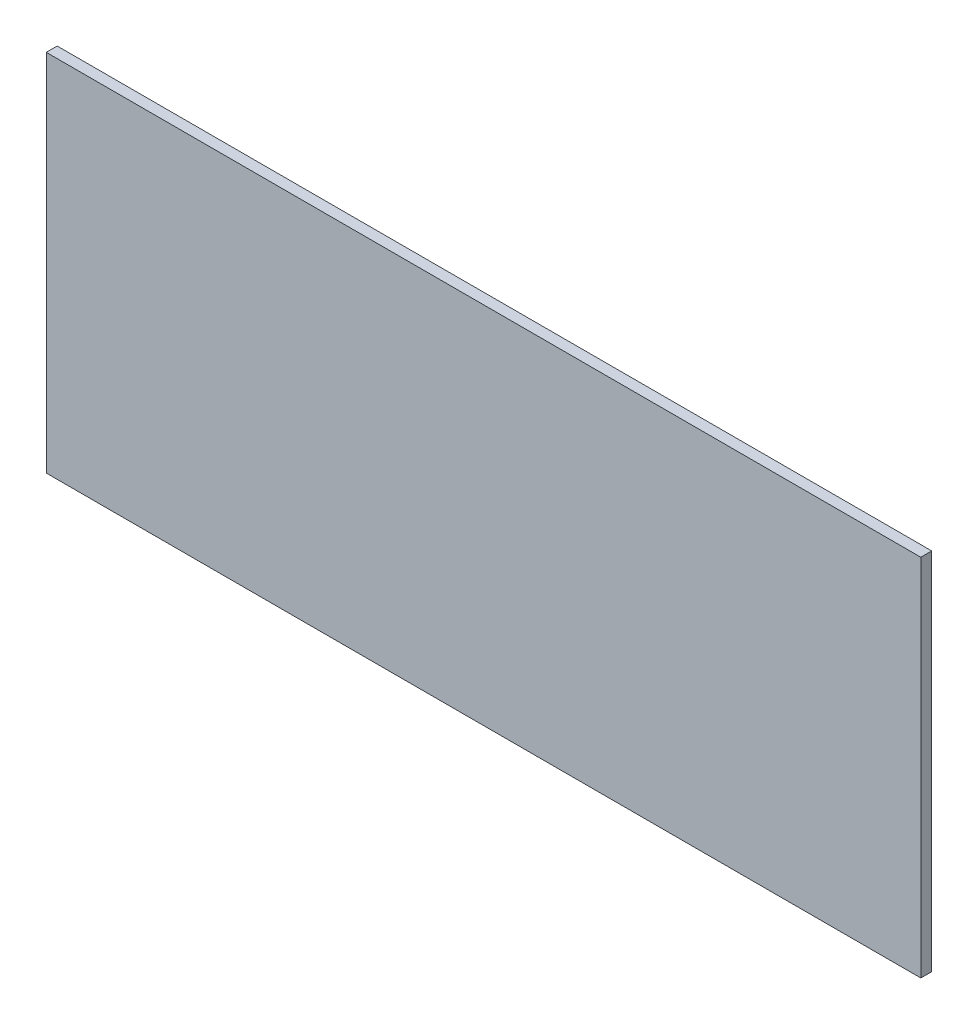
from build123d import *

# Parameters (mm, degrees)
SKETCH1_W           = 1200
SKETCH1_H           = 500
BOSS_EXTRUDE1_DEPTH = 15


with BuildPart() as part:
    # Sketch1 → Boss-Extrude1 (new body)
    with BuildSketch(Plane.XY):
        with Locations((600, 250)):
            Rectangle(SKETCH1_W, SKETCH1_H)
    extrude(amount=BOSS_EXTRUDE1_DEPTH)


solid = part.part
